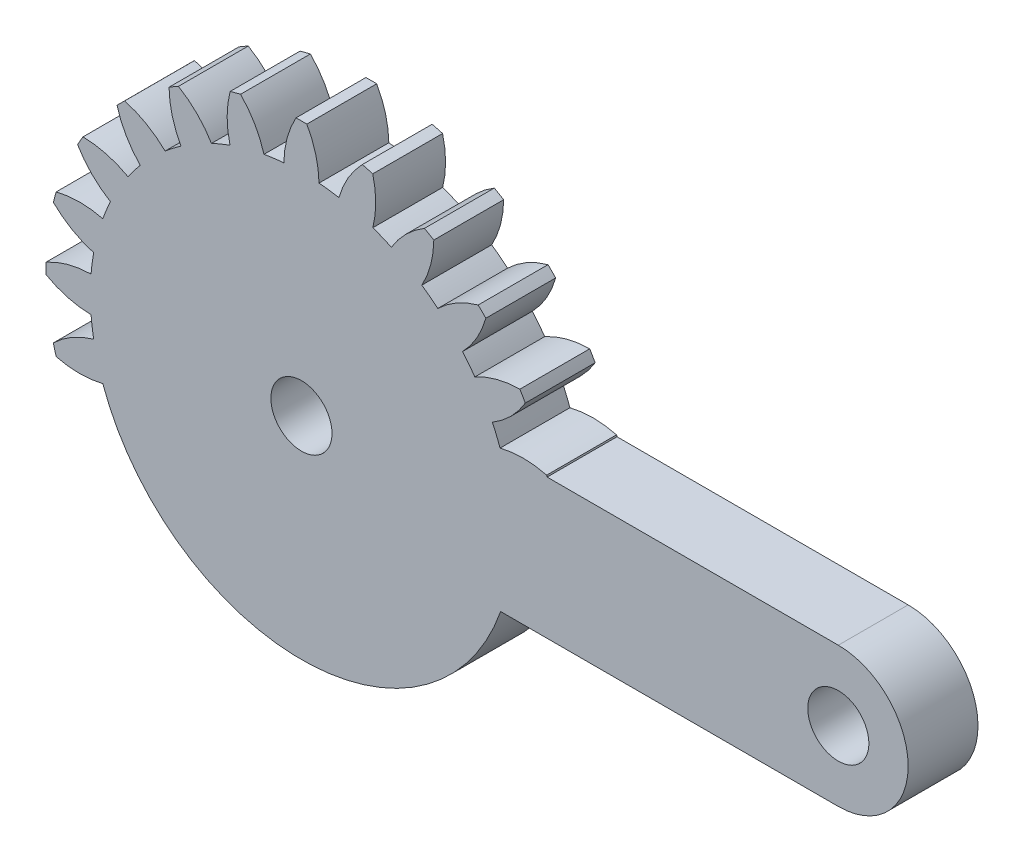
from build123d import *

# Parameters (mm, degrees)
SKETCH1_R           = 1.75
BOSS_EXTRUDE1_DEPTH = 4


with BuildPart() as part:
    # Sketch1 → Boss-Extrude1 (new body)
    with BuildSketch(Plane.XY):
        with BuildLine():
            ThreePointArc((30.75, -4), (34.75, 0), (30.75, 4))
            Line((30.75, 4), (14.072558403, 4))
            ThreePointArc((14.072558403, 4), (14.06038767, 4.04257326), (14.048088143, 4.085109489))
            ThreePointArc((14.048088143, 4.085109489), (12.712915648, 4.255390909), (11.377106712, 4.090176385))
            ThreePointArc((11.377106712, 4.090176385), (11.169703548, 4.626642697), (10.937020765, 5.152637848))
            ThreePointArc((10.937020765, 5.152637848), (11.998404632, 5.980373095), (12.82210701, 7.044889767))
            ThreePointArc((12.82210701, 7.044889767), (12.669951657, 7.315), (12.51210701, 7.581825517))
            ThreePointArc((12.51210701, 7.581825517), (11.17835734, 7.400736668), (9.930825655, 6.8954189))
            ThreePointArc((9.930825655, 6.8954189), (9.591641884, 7.359925677), (9.230750012, 7.807775241))
            ThreePointArc((9.230750012, 7.807775241), (10.041734454, 8.882012453), (10.561852666, 10.123446462))
            ThreePointArc((10.561852666, 10.123446462), (10.344972209, 10.344972209), (10.123446462, 10.561852666))
            ThreePointArc((10.123446462, 10.561852666), (8.882012453, 10.041734454), (7.807775241, 9.230750012))
            ThreePointArc((7.807775241, 9.230750012), (7.359925677, 9.591641884), (6.8954189, 9.930825655))
            ThreePointArc((6.8954189, 9.930825655), (7.400736668, 11.17835734), (7.581825517, 12.51210701))
            ThreePointArc((7.581825517, 12.51210701), (7.315, 12.669951657), (7.044889767, 12.82210701))
            ThreePointArc((7.044889767, 12.82210701), (5.980373095, 11.998404632), (5.152637848, 10.937020765))
            ThreePointArc((5.152637848, 10.937020765), (4.626642697, 11.169703548), (4.090176385, 11.377106712))
            ThreePointArc((4.090176385, 11.377106712), (4.255390909, 12.712915648), (4.085109489, 14.048088143))
            ThreePointArc((4.085109489, 14.048088143), (3.78652263, 14.131494839), (3.486235477, 14.208555951))
            ThreePointArc((3.486235477, 14.208555951), (2.671181194, 13.137403362), (2.1463567, 11.897951627))
            ThreePointArc((2.1463567, 11.897951627), (1.578061664, 11.986568374), (1.00619511, 12.048056748))
            ThreePointArc((1.00619511, 12.048056748), (0.820047291, 13.381109763), (0.31, 14.626715284))
            ThreePointArc((0.31, 14.626715284), (0, 14.63), (-0.31, 14.626715284))
            ThreePointArc((-0.31, 14.626715284), (-0.820047291, 13.381109763), (-1.00619511, 12.048056748))
            ThreePointArc((-1.00619511, 12.048056748), (-1.578061664, 11.986568374), (-2.1463567, 11.897951627))
            ThreePointArc((-2.1463567, 11.897951627), (-2.671181194, 13.137403362), (-3.486235477, 14.208555951))
            ThreePointArc((-3.486235477, 14.208555951), (-3.78652263, 14.131494839), (-4.085109489, 14.048088143))
            ThreePointArc((-4.085109489, 14.048088143), (-4.255390909, 12.712915648), (-4.090176385, 11.377106712))
            ThreePointArc((-4.090176385, 11.377106712), (-4.626642697, 11.169703548), (-5.152637848, 10.937020765))
            ThreePointArc((-5.152637848, 10.937020765), (-5.980373095, 11.998404632), (-7.044889767, 12.82210701))
            ThreePointArc((-7.044889767, 12.82210701), (-7.315, 12.669951657), (-7.581825517, 12.51210701))
            ThreePointArc((-7.581825517, 12.51210701), (-7.400736668, 11.17835734), (-6.8954189, 9.930825655))
            ThreePointArc((-6.8954189, 9.930825655), (-7.359925677, 9.591641884), (-7.807775241, 9.230750012))
            ThreePointArc((-7.807775241, 9.230750012), (-8.882012453, 10.041734454), (-10.123446462, 10.561852666))
            ThreePointArc((-10.123446462, 10.561852666), (-10.344972209, 10.344972209), (-10.561852666, 10.123446462))
            ThreePointArc((-10.561852666, 10.123446462), (-10.041734454, 8.882012453), (-9.230750012, 7.807775241))
            ThreePointArc((-9.230750012, 7.807775241), (-9.591641884, 7.359925677), (-9.930825655, 6.8954189))
            ThreePointArc((-9.930825655, 6.8954189), (-11.17835734, 7.400736668), (-12.51210701, 7.581825517))
            ThreePointArc((-12.51210701, 7.581825517), (-12.669951657, 7.315), (-12.82210701, 7.044889767))
            ThreePointArc((-12.82210701, 7.044889767), (-11.998404632, 5.980373095), (-10.937020765, 5.152637848))
            ThreePointArc((-10.937020765, 5.152637848), (-11.169703548, 4.626642697), (-11.377106712, 4.090176385))
            ThreePointArc((-11.377106712, 4.090176385), (-12.712915648, 4.255390909), (-14.048088143, 4.085109489))
            ThreePointArc((-14.048088143, 4.085109489), (-14.131494839, 3.78652263), (-14.208555951, 3.486235477))
            ThreePointArc((-14.208555951, 3.486235477), (-13.137403362, 2.671181194), (-11.897951627, 2.1463567))
            ThreePointArc((-11.897951627, 2.1463567), (-11.986568374, 1.578061664), (-12.048056748, 1.00619511))
            ThreePointArc((-12.048056748, 1.00619511), (-13.381109763, 0.820047291), (-14.626715284, 0.31))
            ThreePointArc((-14.626715284, 0.31), (-14.63, 0), (-14.626715284, -0.31))
            ThreePointArc((-14.626715284, -0.31), (-13.381109763, -0.820047291), (-12.048056748, -1.00619511))
            ThreePointArc((-12.048056748, -1.00619511), (-11.986568374, -1.578061664), (-11.897951627, -2.1463567))
            ThreePointArc((-11.897951627, -2.1463567), (-13.137403362, -2.671181194), (-14.208555951, -3.486235477))
            ThreePointArc((-14.208555951, -3.486235477), (-14.131494839, -3.78652263), (-14.048088143, -4.085109489))
            ThreePointArc((-14.048088143, -4.085109489), (-12.712915648, -4.255390909), (-11.377106712, -4.090176385))
            ThreePointArc((-11.377106712, -4.090176385), (0.047845736, -12.089905326), (11.409123542, -4))
            Line((11.409123542, -4), (30.75, -4))
        make_face()
        Circle(SKETCH1_R, mode=Mode.SUBTRACT)
        with Locations((30.75, 0)):
            Circle(SKETCH1_R, mode=Mode.SUBTRACT)
    extrude(amount=BOSS_EXTRUDE1_DEPTH)


solid = part.part
